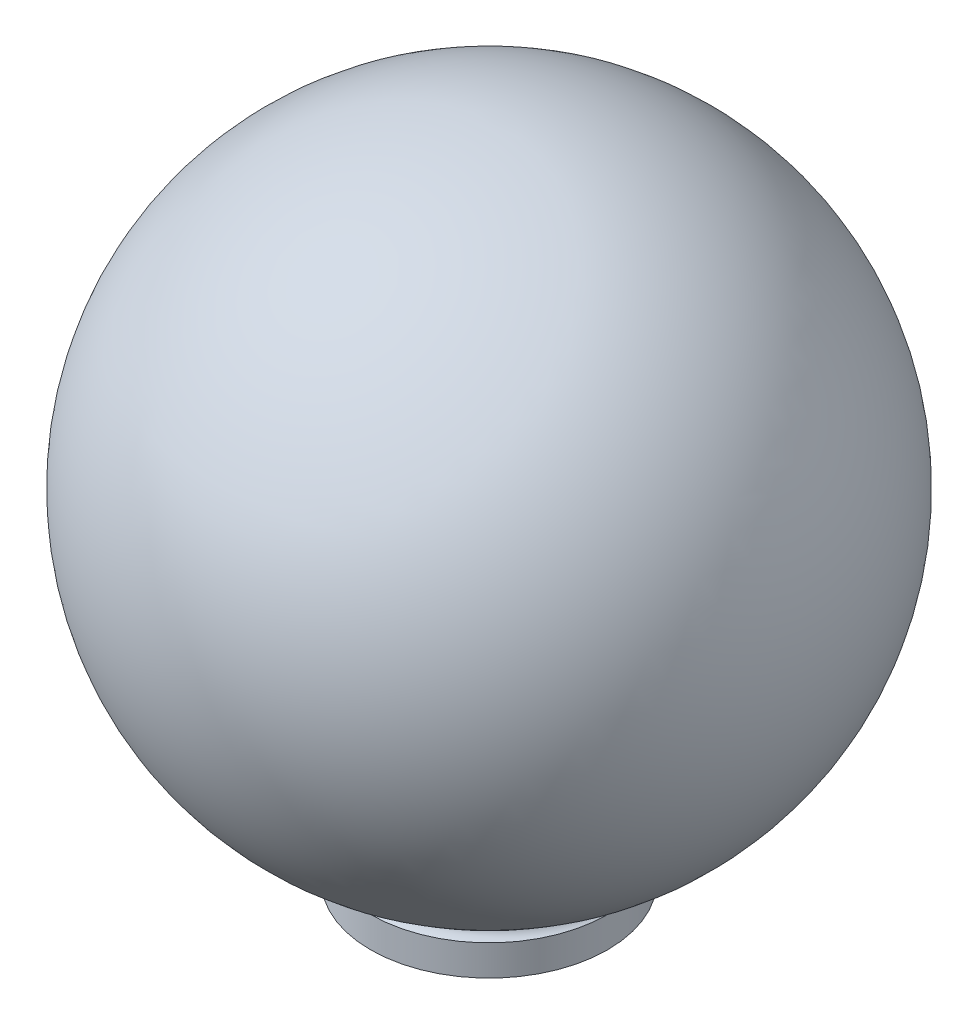
from build123d import *


with BuildPart() as part:
    # Sketch1 → Revolve1 (revolve)
    with BuildSketch(Plane.XY, mode=Mode.PRIVATE) as revolve1_sk:
        with BuildLine():
            Line((43.942, 0), (43.942, 19.96))
            ThreePointArc((43.942, 19.96), (124.100677632, 160.471724863), (0, 264.240603795))
            Line((0, 264.240603795), (0, 265.148086015))
            ThreePointArc((0, 265.148086015), (124.777575958, 161.803033448), (46.482, 19.96))
            ThreePointArc((46.482, 19.96), (45.690130632, 15.830063219), (48.133, 12.407224607))
            Line((48.133, 12.407224607), (48.133, 0))
            Line((48.133, 0), (43.942, 0))
        make_face()
    revolve(revolve1_sk.sketch.rotate(Axis((0, 0, 0), (0, 1, 0)), 90), axis=Axis((0, 0, 0), (0, 1, 0)))


solid = part.part
